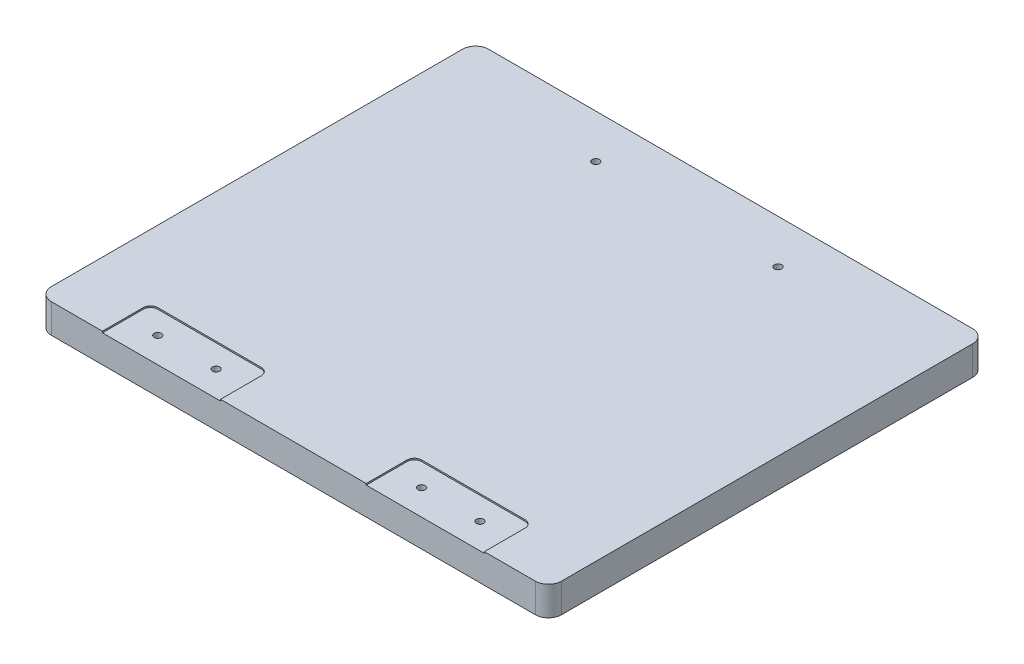
from build123d import *

# Parameters (mm, degrees)
SKETCH_1_W             = 350
SKETCH_1_H             = 300
EXTRUDE_1_DEPTH        = 20
FILLET_1_R             = 9
CUT_EXTRUDE_1_DEPTH    = 1
HOLE_WIZARD_M6_1_D     = 5
HOLE_WIZARD_M6_1_DEPTH = 14
HOLE_WIZARD_M6_1_TIP   = 1.502151548
HOLE_WIZARD_M6_2_D     = 5
HOLE_WIZARD_M6_2_DEPTH = 12
HOLE_WIZARD_M6_2_TIP   = 1.502151548


with BuildPart() as part:
    # 스케치1 → 보스-돌출1 (new body)
    with BuildSketch(Plane(origin=(0, 0, 0), x_dir=(1, 0, 0), z_dir=(0, 1, 0))):
        Rectangle(SKETCH_1_W, SKETCH_1_H)
    extrude(amount=EXTRUDE_1_DEPTH)

    # 필렛1
    fillet_1_edges = [part.edges().sort_by_distance(p)[0] for p in [
        (175, 10, 150),
        (-175, 10, 150),
        (-175, 10, -150),
        (175, 10, -150),
    ]]
    fillet(fillet_1_edges, radius=FILLET_1_R)

    # 스케치2 → 컷-돌출1 (cut)
    with BuildSketch(Plane(origin=(0, 20, 0), x_dir=(1, 0, 0), z_dir=(0, 1, 0))):
        with BuildLine():
            Line((-131, -150), (-50, -150))
            Line((-50, -150), (-50, -122))
            ThreePointArc((-50, -122), (-51.464466094, -118.464466094), (-55, -117))
            Line((-55, -117), (-126, -117))
            ThreePointArc((-126, -117), (-129.535533906, -118.464466094), (-131, -122))
            Line((-131, -122), (-131, -150))
        make_face()
        with BuildLine():
            Line((50, -150), (131, -150))
            Line((131, -150), (131, -122))
            ThreePointArc((131, -122), (129.535533906, -118.464466094), (126, -117))
            Line((126, -117), (55, -117))
            ThreePointArc((55, -117), (51.464466094, -118.464466094), (50, -122))
            Line((50, -122), (50, -150))
        make_face()
    extrude(amount=-CUT_EXTRUDE_1_DEPTH, mode=Mode.SUBTRACT)

    # M6 나사 구멍1
    with Locations(Plane(origin=(0, 19, 0), x_dir=(1, 0, 0), z_dir=(0, 1, 0))):
        with Locations((-110.5, -132.5), (-70.5, -132.5), (70.5, -132.5), (110.5, -132.5)):
            Hole(HOLE_WIZARD_M6_1_D / 2, depth=HOLE_WIZARD_M6_1_DEPTH)
            with Locations((0, 0, -(HOLE_WIZARD_M6_1_DEPTH + HOLE_WIZARD_M6_1_TIP / 2))):  # 118° drill point
                Cone(0, HOLE_WIZARD_M6_1_D / 2, HOLE_WIZARD_M6_1_TIP, mode=Mode.SUBTRACT)

    # M6 나사 구멍2
    with Locations(Plane(origin=(0, 20, 0), x_dir=(1, 0, 0), z_dir=(0, 1, 0))):
        with Locations((-62.5, 120), (62.5, 120)):
            Hole(HOLE_WIZARD_M6_2_D / 2, depth=HOLE_WIZARD_M6_2_DEPTH)
            with Locations((0, 0, -(HOLE_WIZARD_M6_2_DEPTH + HOLE_WIZARD_M6_2_TIP / 2))):  # 118° drill point
                Cone(0, HOLE_WIZARD_M6_2_D / 2, HOLE_WIZARD_M6_2_TIP, mode=Mode.SUBTRACT)


solid = part.part
